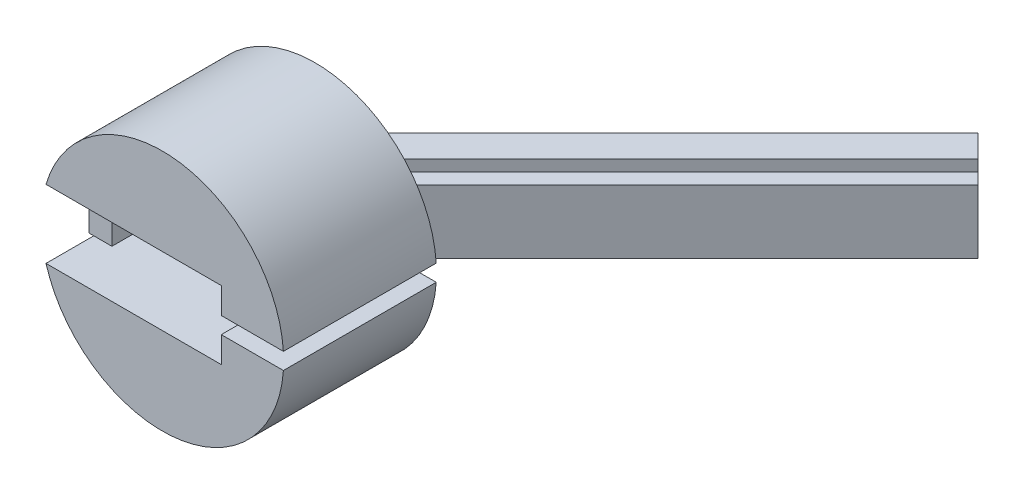
from build123d import *

# Parameters (mm, degrees)
BOSS_EXTRUDE1_DEPTH = 28
BOSS_EXTRUDE5_DEPTH = 5
BOSS_EXTRUDE6_DEPTH = 10
BOSS_EXTRUDE7_REACH = 204.915
BOSS_EXTRUDE8_START = 15
BOSS_EXTRUDE8_DEPTH = 15


with BuildPart() as part:
    # Sketch3 → Boss-Extrude1 (new body)
    with BuildSketch(Plane.XY):
        with BuildLine():
            Line((10.849101299, -10.749101299), (10.849101299, -4.6))
            Line((10.849101299, -4.6), (12.849101299, -2.6))
            Line((12.849101299, -2.6), (38.011182565, -2.6))
            ThreePointArc((38.011182565, -2.6), (4.13933396, -37.874475764), (-36.552247828, -10.749101299))
            Line((-36.552247828, -10.749101299), (-38.1, -10.749101299))
            Line((-38.1, -10.749101299), (-38.1, 10.749101299))
            Line((-38.1, 10.749101299), (-36.552247828, 10.749101299))
            ThreePointArc((-36.552247828, 10.749101299), (4.13933396, 37.874475764), (38.011182565, 2.6))
            Line((38.011182565, 2.6), (12.849101299, 2.6))
            Line((12.849101299, 2.6), (10.849101299, 4.6))
            Line((10.849101299, 4.6), (10.849101299, 10.749101299))
            Line((10.849101299, 10.749101299), (-30.849101299, 10.749101299))
            Line((-30.849101299, 10.749101299), (-30.849101299, -10.749101299))
            Line((-30.849101299, -10.749101299), (10.849101299, -10.749101299))
        make_face()
    extrude(amount=-BOSS_EXTRUDE1_DEPTH)

    # Sketch7 → Boss-Extrude5 (add)
    with BuildSketch(Plane(origin=(0, 0, -28), x_dir=(-1, 0, 0), z_dir=(0, 0, -1))):
        with BuildLine():
            Line((-12.849101299, 2.6), (-12.849101299, -2.6))
            Line((-12.849101299, -2.6), (-38.011182565, -2.6))
            ThreePointArc((-38.011182565, -2.6), (-4.13933396, -37.874475764), (36.552247828, -10.749101299))
            Line((36.552247828, -10.749101299), (38.1, -10.749101299))
            Line((38.1, -10.749101299), (38.1, 10.749101299))
            Line((38.1, 10.749101299), (36.552247828, 10.749101299))
            ThreePointArc((36.552247828, 10.749101299), (-4.13933396, 37.874475764), (-38.011182565, 2.6))
            Line((-38.011182565, 2.6), (-12.849101299, 2.6))
        make_face()
    extrude(amount=BOSS_EXTRUDE5_DEPTH)

    # Sketch8 → Boss-Extrude6 (add, symmetric)
    with BuildSketch(Plane(origin=(0, 0, 0), x_dir=(1, 0, 0), z_dir=(0, 1, 0))):
        Polygon((-3.957864376, 33), (102.108152802, 139.066017178), (95.03708499, 146.13708499), (-18.1, 33), align=None)
    extrude(amount=BOSS_EXTRUDE6_DEPTH, both=True)

    # Boss-Extrude7: up to this plane
    boss_extrude7_end = Plane(origin=(0, 0, -33), z_dir=(0, 0, -1))
    # Sketch9 → Boss-Extrude7 (add, up to the surface)
    with BuildSketch(Plane(origin=(120.58708499, 0, -120.58708499), x_dir=(-0.70710678118655, 0, -0.7071067811865451), z_dir=(0.7071067811865451, 0, -0.70710678118655)), mode=Mode.PRIVATE) as boss_extrude7_sk1:
        Polygon((26.133156519, 5), (21.133156519, 5), (21.133156519, 10), (16.133156519, 10), (16.133156519, -10), (21.133156519, -10), (21.133156519, -5), (26.133156519, -5), align=None)
    boss_extrude7_tool1 = split(extrude(boss_extrude7_sk1.sketch, amount=-BOSS_EXTRUDE7_REACH, mode=Mode.PRIVATE), bisect_by=boss_extrude7_end, keep=Keep.BOTH, mode=Mode.PRIVATE)
    add(boss_extrude7_tool1.solids().sort_by_distance((106.232942, 0, -134.941228))[0])

    # Sketch12 → Boss-Extrude8 (add)
    with BuildSketch(Plane.XY.offset(BOSS_EXTRUDE8_START)):
        with BuildLine():
            Line((-36.552247828, 10.749101299), (18.5, 10.749101299))
            Line((18.5, 10.749101299), (18.5, 2.6))
            Line((18.5, 2.6), (38.011182565, 2.6))
            ThreePointArc((38.011182565, 2.6), (4.13933396, 37.874475764), (-36.552247828, 10.749101299))
        make_face()
        with BuildLine():
            Line((-36.552247828, -10.749101299), (18.5, -10.749101299))
            Line((18.5, -10.749101299), (18.5, -2.6))
            Line((18.5, -2.6), (38.011182565, -2.6))
            ThreePointArc((38.011182565, -2.6), (4.13933396, -37.874475764), (-36.552247828, -10.749101299))
        make_face()
    extrude(amount=-BOSS_EXTRUDE8_DEPTH)


solid = part.part
